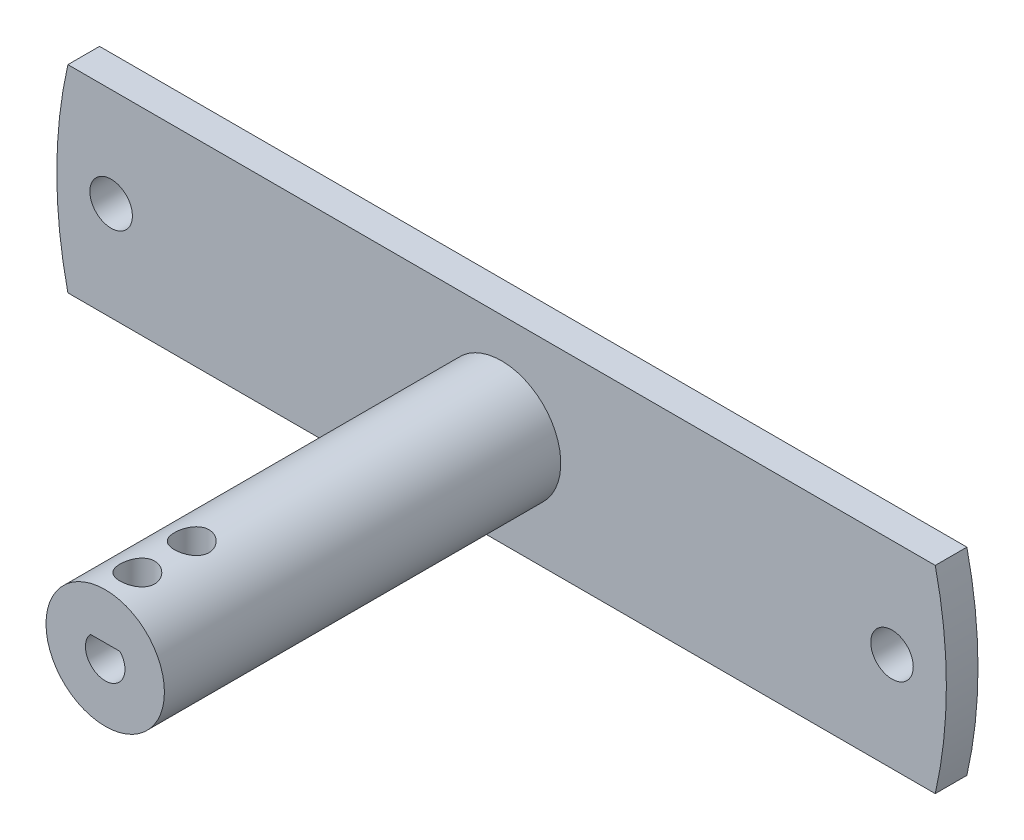
from build123d import *

# Parameters (mm, degrees)
CROQUIS1_R                 = 5.99
SALIENTE_EXTRUIR1_DEPTH    = 43.3
CROQUIS2_R                 = 1.75
CORTAR_EXTRUIR1_DEPTH      = 7.5
CROQUIS3_R                 = 45
SALIENTE_EXTRUIR2_DEPTH    = 3.2
CORTAR_EXTRUIR2_DEPTH      = 77.973307118
CORTAR_EXTRUIR2_DEPTH_BACK = 5
CROQUIS5_R                 = 2.15


with BuildPart() as part:
    # Croquis1 → Saliente-Extruir1 (new body)
    with BuildSketch(Plane.XY):
        with Locations(Location((0, 0, 0), (0, 0, 180))):
            Circle(CROQUIS1_R)
        with BuildLine():
            Line((-1.5, 1.322875656), (1.5, 1.322875656))
            ThreePointArc((1.5, 1.322875656), (0, -2), (-1.5, 1.322875656))
        make_face(mode=Mode.SUBTRACT)
    extrude(amount=SALIENTE_EXTRUIR1_DEPTH)

    # Croquis2 → Cortar-Extruir1 (cut)
    with BuildSketch(Plane(origin=(0, 1.322875656, 0), x_dir=(1, 0, 0), z_dir=(0, 1, 0))):
        with Locations((0, -40.05)):
            Circle(CROQUIS2_R)
        with Locations((0, -34.55)):
            Circle(CROQUIS2_R)
    extrude(amount=CORTAR_EXTRUIR1_DEPTH, mode=Mode.SUBTRACT)

    # Croquis3 → Saliente-Extruir2 (add)
    with BuildSketch(Plane(origin=(0, 0, 0), x_dir=(-1, 0, 0), z_dir=(0, 0, -1))):
        Circle(CROQUIS3_R)
    extrude(amount=-SALIENTE_EXTRUIR2_DEPTH)

    # Croquis5 → Cortar-Extruir2 (cut, two sides: drawn at the far end of the back side and taken through both)
    with BuildSketch(Plane(origin=(0, 0, 0), x_dir=(-1, 0, 0), z_dir=(0, 0, -1)).offset(-CORTAR_EXTRUIR2_DEPTH_BACK)):
        with Locations(Location((-39.5, 0, 0), (0, 0, 180))):
            Circle(CROQUIS5_R)
        with Locations(Location((39.5, 0, 0), (0, 0, 180))):
            Circle(CROQUIS5_R)
        Polygon((0, 10), (-75, 10), (-75, 50), (75, 50), (75, 10), align=None)
        Polygon((75, -50), (75, -10), (0, -10), (-75, -10), (-75, -50), align=None)
    extrude(amount=CORTAR_EXTRUIR2_DEPTH + CORTAR_EXTRUIR2_DEPTH_BACK, mode=Mode.SUBTRACT)


solid = part.part
